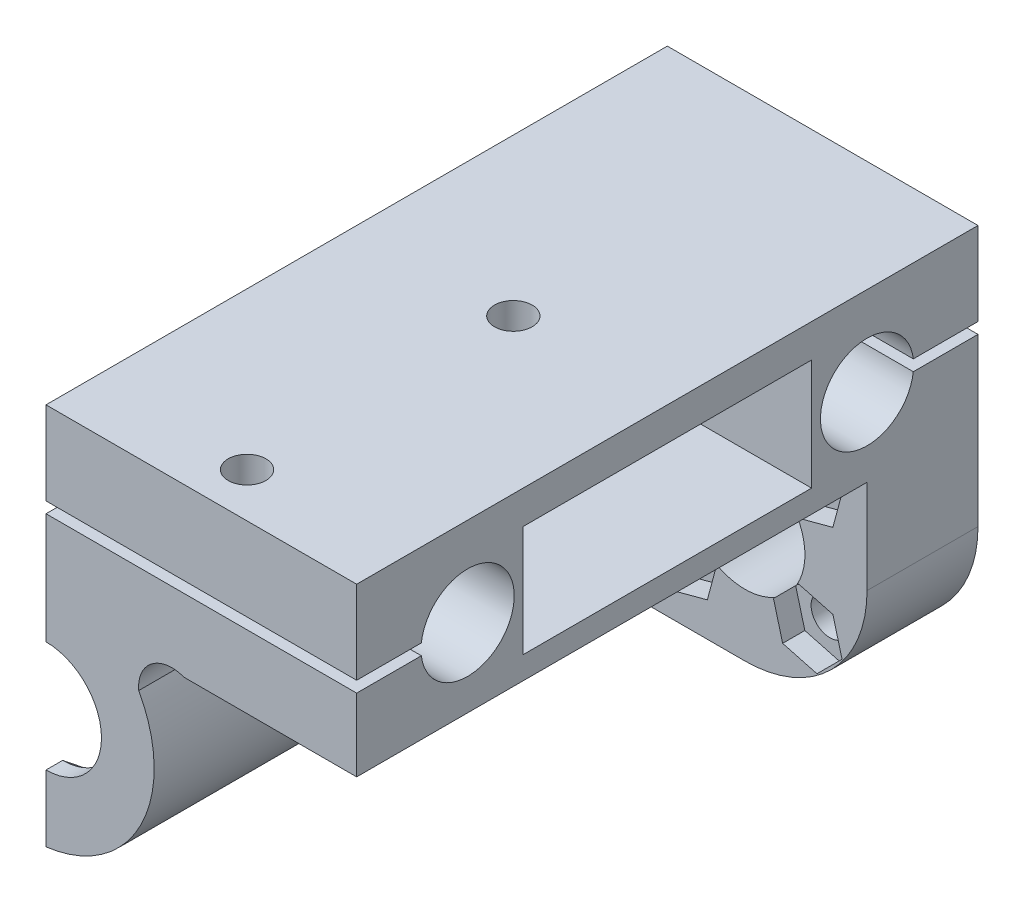
from build123d import *

# Parameters (mm, degrees)
SKETCH_1_R          = 1.7
SKETCH_1_R_2        = 5.4
EXTRUDE_1_DEPTH     = 10
EXTRUDE_START       = 10
EXTRUDE_2_DEPTH     = 10
CUT_EXTRUDE_START   = -10
CUT_EXTRUDE_1_DEPTH = 2
EXTRUDE_START_2     = 20
EXTRUDE_3_DEPTH     = 36
EXTRUDE_4_DEPTH     = 3.5
EXTRUDE_START_3     = 52
EXTRUDE_5_DEPTH     = 4
CUT_EXTRUDE_2_REACH = 69.936
SKETCH_7_R          = 1.7
SKETCH_7_W          = 2.5
SKETCH_7_H          = 4.5
SKETCH_8_W          = 26
SKETCH_8_H          = 10
CUT_EXTRUDE_3_DEPTH = 67.874883177
SKETCH_9_W          = 2.5
SKETCH_9_H          = 4.5
EXTRUDE_10_DEPTH    = 3
FILLET_1_R          = 2
CHAMFER_3_SIZE      = 2.5
CHAMFER_3_SIZE2     = 2


with BuildPart() as part:
    # 草图1 → 凸台-拉伸1 (new body)
    with BuildSketch(Plane.XY):
        with BuildLine():
            Line((-17, -7.5), (-17, -11))
            Line((-17, -11), (0, -11))
            ThreePointArc((0, -11), (7.778174593, -7.778174593), (11, 0))
            Line((11, 0), (11, 23.5))
            Line((11, 23.5), (-17, 23.5))
            Line((-17, 23.5), (-17, 7.5))
            ThreePointArc((-17, 7.5), (-9.5, 0), (-17, -7.5))
        make_face()
        with Locations((-5.656854249, -5.656854249)):
            Circle(SKETCH_1_R, mode=Mode.SUBTRACT)
        with Locations((5.656854249, -5.656854249)):
            Circle(SKETCH_1_R, mode=Mode.SUBTRACT)
        Circle(SKETCH_1_R_2, mode=Mode.SUBTRACT)
        with Locations((-5.656854249, 5.656854249)):
            Circle(SKETCH_1_R, mode=Mode.SUBTRACT)
        with Locations((5.656854249, 5.656854249)):
            Circle(SKETCH_1_R, mode=Mode.SUBTRACT)
    extrude(amount=EXTRUDE_1_DEPTH)

    # 草图1<6> → 凸台-拉伸2 (add)
    with BuildSketch(Plane.XY.offset(EXTRUDE_START)):
        with BuildLine():
            Line((11, 8.456854249), (11, 23.5))
            Line((11, 23.5), (-17, 23.5))
            Line((-17, 23.5), (-17, 7.5))
            ThreePointArc((-17, 7.5), (-9.5, 0), (-17, -7.5))
            Line((-17, -7.5), (-17, -11))
            ThreePointArc((-17, -11), (-8.462447466, -5.036106671), (-8.643737412, 5.376624039))
            ThreePointArc((-8.643737412, 5.376624039), (-7.46899014, 8.047704206), (-4.579821288, 8.456854249))
            Line((-4.579821288, 8.456854249), (11, 8.456854249))
        make_face()
    extrude(amount=EXTRUDE_2_DEPTH)

    # 草图3 → 切除-拉伸1 (cut)
    with BuildSketch(Plane(origin=(0, 0, 0), x_dir=(-1, 0, 0), z_dir=(0, 0, -1)).offset(CUT_EXTRUDE_START)):
        Polygon((7.919595949, 3.39411255), (8.747816894, 6.485075194), (6.485075194, 8.747816894), (3.39411255, 7.919595949), (2.565891605, 4.828633305), (4.828633305, 2.565891605), align=None)
        Polygon((-2.565891605, 4.828633305), (-3.39411255, 7.919595949), (-6.485075194, 8.747816894), (-8.747816894, 6.485075194), (-7.919595949, 3.39411255), (-4.828633305, 2.565891605), align=None)
        Polygon((-3.39411255, -7.919595949), (-2.565891605, -4.828633305), (-4.828633305, -2.565891605), (-7.919595949, -3.39411255), (-8.747816894, -6.485075194), (-6.485075194, -8.747816894), align=None)
        Polygon((2.565891605, -4.828633305), (3.39411255, -7.919595949), (6.485075194, -8.747816894), (8.747816894, -6.485075194), (7.919595949, -3.39411255), (4.828633305, -2.565891605), align=None)
    extrude(amount=CUT_EXTRUDE_1_DEPTH, mode=Mode.SUBTRACT)

    # 草图1<7> → 凸台-拉伸3 (add)
    with BuildSketch(Plane.XY.offset(EXTRUDE_START_2)):
        with BuildLine():
            Line((11, 8.456854249), (11, 23.5))
            Line((11, 23.5), (-17, 23.5))
            Line((-17, 23.5), (-17, 7.5))
            ThreePointArc((-17, 7.5), (-9.5, 0), (-17, -7.5))
            Line((-17, -7.5), (-17, -11))
            ThreePointArc((-17, -11), (-8.462447466, -5.036106671), (-8.643737412, 5.376624039))
            ThreePointArc((-8.643737412, 5.376624039), (-7.46899014, 8.047704206), (-4.579821288, 8.456854249))
            Line((-4.579821288, 8.456854249), (11, 8.456854249))
        make_face()
    extrude(amount=EXTRUDE_3_DEPTH)

    # 草图1<8> → 凸台-拉伸4 (add)
    with BuildSketch(Plane.XY):
        with BuildLine():
            Line((-17, -5), (-17, -7.5))
            ThreePointArc((-17, -7.5), (-9.5, 0), (-17, 7.5))
            Line((-17, 7.5), (-17, 5))
            ThreePointArc((-17, 5), (-12, 0), (-17, -5))
        make_face()
    extrude(amount=EXTRUDE_4_DEPTH)

    # 草图1<9> → 凸台-拉伸5 (add)
    with BuildSketch(Plane.XY.offset(EXTRUDE_START_3)):
        with BuildLine():
            Line((-17, -5), (-17, -7.5))
            ThreePointArc((-17, -7.5), (-9.5, 0), (-17, 7.5))
            Line((-17, 7.5), (-17, 5))
            ThreePointArc((-17, 5), (-12, 0), (-17, -5))
        make_face()
    extrude(amount=EXTRUDE_5_DEPTH)

    # 草图7 → 切除-拉伸2 (cut, up to next)
    with BuildSketch(Plane(origin=(0, 23.5, 0), x_dir=(1, 0, 0), z_dir=(0, 1, 0)), mode=Mode.PRIVATE) as cut_extrude_2_sk1:
        with Locations(Location((-2.879821288, -28, 0), (0, 0, 180))):
            Circle(SKETCH_7_R)
    cut_extrude_2_tool1 = extrude(cut_extrude_2_sk1.sketch, amount=-CUT_EXTRUDE_2_REACH, mode=Mode.PRIVATE) & part.part
    # 草图7 → 切除-拉伸2 (cut, up to next)
    with BuildSketch(Plane(origin=(0, 23.5, 0), x_dir=(1, 0, 0), z_dir=(0, 1, 0)), mode=Mode.PRIVATE) as cut_extrude_2_sk2:
        with Locations(Location((-2.879821288, -52, 0), (0, 0, 180))):
            Circle(SKETCH_7_R)
    cut_extrude_2_tool2 = extrude(cut_extrude_2_sk2.sketch, amount=-CUT_EXTRUDE_2_REACH, mode=Mode.PRIVATE) & part.part
    # 草图7 → 切除-拉伸2 (cut, up to next)
    with BuildSketch(Plane(origin=(0, 23.5, 0), x_dir=(1, 0, 0), z_dir=(0, 1, 0)), mode=Mode.PRIVATE) as cut_extrude_2_sk3:
        with Locations((-7.393737412, -38.75)):
            Rectangle(SKETCH_7_W, SKETCH_7_H)
    cut_extrude_2_tool3 = extrude(cut_extrude_2_sk3.sketch, amount=-CUT_EXTRUDE_2_REACH, mode=Mode.PRIVATE) & part.part
    # 草图7 → 切除-拉伸2 (cut, up to next)
    with BuildSketch(Plane(origin=(0, 23.5, 0), x_dir=(1, 0, 0), z_dir=(0, 1, 0)), mode=Mode.PRIVATE) as cut_extrude_2_sk4:
        with Locations((-7.393737412, -17.25)):
            Rectangle(SKETCH_7_W, SKETCH_7_H)
    cut_extrude_2_tool4 = extrude(cut_extrude_2_sk4.sketch, amount=-CUT_EXTRUDE_2_REACH, mode=Mode.PRIVATE) & part.part
    add(cut_extrude_2_tool1.solids().sort_by_distance((-2.879821, 23.5, 28))[0], mode=Mode.SUBTRACT)
    add(cut_extrude_2_tool2.solids().sort_by_distance((-2.879821, 23.5, 52))[0], mode=Mode.SUBTRACT)
    add(cut_extrude_2_tool3.solids().sort_by_distance((-7.393737, 23.5, 38.75))[0], mode=Mode.SUBTRACT)
    add(cut_extrude_2_tool4.solids().sort_by_distance((-7.393737, 23.5, 17.25))[0], mode=Mode.SUBTRACT)

    # 草图8 → 切除-拉伸3 (cut, through all)
    with BuildSketch(Plane(origin=(11, 0, 0), x_dir=(0, 0, -1), z_dir=(1, 0, 0))):
        with Locations((18, 15.5)):
            Rectangle(SKETCH_8_W, SKETCH_8_H)
        with BuildLine():
            ThreePointArc((-46, 19.7), (-48.787471973, 18.641655614), (-50.170131892, 16))
            ThreePointArc((-50.170131892, 16), (-50.2, 15.5), (-50.170131892, 15))
            ThreePointArc((-50.170131892, 15), (-48.787471973, 12.358344386), (-46, 11.3))
            Line((-46, 11.3), (-46, 19.7))
        make_face()
        with BuildLine():
            ThreePointArc((-41.8, 15.5), (-43.030151519, 18.469848481), (-46, 19.7))
            Line((-46, 19.7), (-46, 11.3))
            ThreePointArc((-46, 11.3), (-43.030151519, 12.530151519), (-41.8, 15.5))
        make_face()
        with BuildLine():
            ThreePointArc((-10, 11.3), (-7.212528027, 12.358344386), (-5.829868108, 15))
            ThreePointArc((-5.829868108, 15), (-5.807473676, 15.249554345), (-5.8, 15.5))
            ThreePointArc((-5.8, 15.5), (-5.807473676, 15.750445655), (-5.829868108, 16))
            ThreePointArc((-5.829868108, 16), (-7.212528027, 18.641655614), (-10, 19.7))
            Line((-10, 19.7), (-10, 11.3))
        make_face()
        with BuildLine():
            ThreePointArc((-10, 19.7), (-14.2, 15.5), (-10, 11.3))
            Line((-10, 11.3), (-10, 19.7))
        make_face()
        with BuildLine():
            Line((-50.170131892, 16), (-56, 16))
            Line((-56, 16), (-56, 15))
            Line((-56, 15), (-50.170131892, 15))
            ThreePointArc((-50.170131892, 15), (-50.2, 15.5), (-50.170131892, 16))
        make_face()
        with BuildLine():
            ThreePointArc((-5.8, 15.5), (-5.807473676, 15.249554345), (-5.829868108, 15))
            Line((-5.829868108, 15), (0, 15))
            Line((0, 15), (0, 16))
            Line((0, 16), (-5.829868108, 16))
            ThreePointArc((-5.829868108, 16), (-5.807473676, 15.750445655), (-5.8, 15.5))
        make_face()
        Polygon((-41, 10.5), (-28, 15.5), (-41, 20.5), align=None)
        Polygon((-28, 15.5), (-15, 20.5), (-41, 20.5), align=None)
        Polygon((-15, 10.5), (-15, 20.5), (-28, 15.5), align=None)
        Polygon((-15, 10.5), (-28, 15.5), (-41, 10.5), align=None)
    extrude(amount=-CUT_EXTRUDE_3_DEPTH, mode=Mode.SUBTRACT)

    # 草图9 → 凸台-拉伸10 (add)
    with BuildSketch(Plane(origin=(0, 23.5, 0), x_dir=(1, 0, 0), z_dir=(0, 1, 0))):
        with Locations((-7.393737412, -17.25)):
            Rectangle(SKETCH_9_W, SKETCH_9_H)
        with Locations((-7.393737412, -38.75)):
            Rectangle(SKETCH_9_W, SKETCH_9_H)
    extrude(amount=-EXTRUDE_10_DEPTH)

    # 圆角1
    fillet_1_edges = [part.edges().sort_by_distance(p)[0] for p in [
        (-8.643737412, 10.5, 38.75),
        (-8.643737412, 10.5, 17.25),
    ]]
    fillet(fillet_1_edges, radius=FILLET_1_R)

    # 倒角3
    chamfer_3_edges = [part.edges().sort_by_distance(p)[0] for p in [
        (-12, 0, 52),
    ]]
    chamfer_3_side = [part.faces().sort_by_distance(p)[0] for p in [
        (-12, 0, 54),
    ]]
    chamfer(chamfer_3_edges, length=CHAMFER_3_SIZE, length2=CHAMFER_3_SIZE2, reference=chamfer_3_side[0])


solid = part.part
